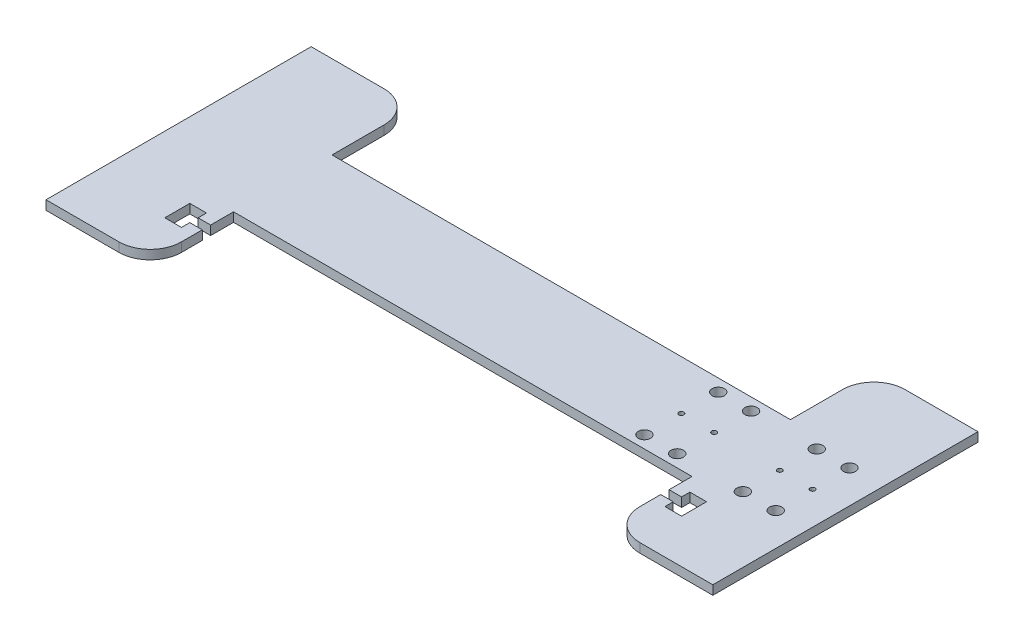
from build123d import *

# Parameters (mm, degrees)
BOSS_EXTRUDE1_DEPTH = 5.588
FILLET1_R           = 19.05
SKETCH2_R           = 1.5
SKETCH2_R_2         = 3.75
CUT_EXTRUDE1_DEPTH  = 438.386266067


with BuildPart() as part:
    # Sketch1 → Boss-Extrude1 (new body)
    with BuildSketch(Plane(origin=(0, 0, 0), x_dir=(1, 0, 0), z_dir=(0, 1, 0))):
        Polygon((0, 161.6), (0, 0), (63.5, 0), (63.5, 31.75), (55.88, 31.75), (55.88, 26.67), (45.72, 26.67), (45.72, 41.91), (55.88, 41.91), (55.88, 36.83), (63.5, 36.83), (63.5, 50.8), (342.9, 50.8), (342.9, 36.83), (350.52, 36.83), (350.52, 41.91), (360.68, 41.91), (360.68, 26.67), (350.52, 26.67), (350.52, 31.75), (342.9, 31.75), (342.9, 0), (406.4, 0), (406.4, 161.6), (342.9, 161.6), (342.9, 110.8), (63.5, 110.8), (63.5, 161.6), align=None)
    extrude(amount=BOSS_EXTRUDE1_DEPTH)

    # Fillet1
    fillet1_edges = [part.edges().sort_by_distance(p)[0] for p in [
        (63.5, 2.794, 0),
        (63.5, 2.794, -161.6),
        (342.9, 2.794, -161.6),
        (342.9, 2.794, 0),
    ]]
    fillet(fillet1_edges, radius=FILLET1_R)

    # Sketch2 → Cut-Extrude1 (cut, through all)
    with BuildSketch(Plane(origin=(0, 5.588, 0), x_dir=(1, 0, 0), z_dir=(0, 1, 0))):
        with Locations(Location((366.4, 80.8, 0), (0, 0, 270))):
            Circle(SKETCH2_R)
        with Locations(Location((386.4, 80.8, 0), (0, 0, 270))):
            Circle(SKETCH2_R)
        with Locations(Location((366.4, 103.3, 0), (0, 0, 270))):
            Circle(SKETCH2_R_2)
        with Locations(Location((386.4, 103.3, 0), (0, 0, 270))):
            Circle(SKETCH2_R_2)
        with Locations(Location((386.4, 58.3, 0), (0, 0, 90))):
            Circle(SKETCH2_R_2)
        with Locations(Location((366.4, 58.3, 0), (0, 0, 90))):
            Circle(SKETCH2_R_2)
        with Locations(Location((306.4, 103.3, 0), (0, 0, 270))):
            Circle(SKETCH2_R_2)
        with Locations(Location((326.4, 103.3, 0), (0, 0, 270))):
            Circle(SKETCH2_R_2)
        with Locations(Location((326.4, 80.8, 0), (0, 0, 270))):
            Circle(SKETCH2_R)
        with Locations(Location((306.4, 80.8, 0), (0, 0, 270))):
            Circle(SKETCH2_R)
        with Locations(Location((306.4, 58.3, 0), (0, 0, 90))):
            Circle(SKETCH2_R_2)
        with Locations(Location((326.4, 58.3, 0), (0, 0, 90))):
            Circle(SKETCH2_R_2)
    extrude(amount=-CUT_EXTRUDE1_DEPTH, mode=Mode.SUBTRACT)


solid = part.part
